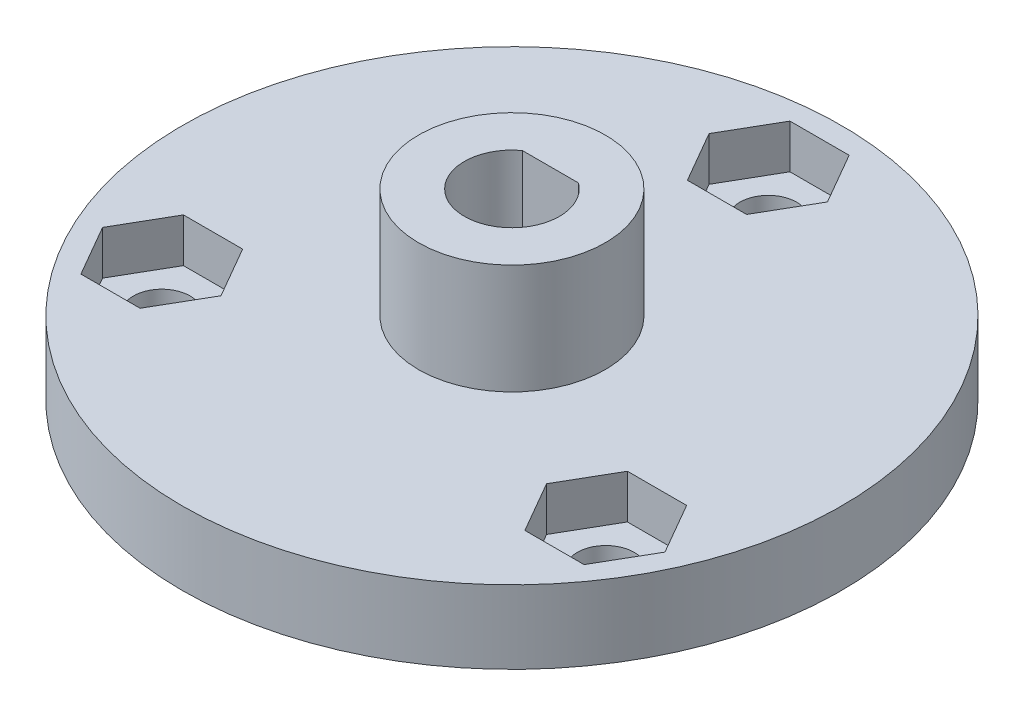
from build123d import *

# Parameters (mm, degrees)
SKETCH_1_R          = 18
SKETCH_1_R_2        = 1.55
EXTRUDE_1_DEPTH     = 4
SKETCH_3_R          = 2.6
CUT_EXTRUDE_2_DEPTH = 2
CUT_EXTRUDE_3_DEPTH = 26.53429067
SKETCH_5_R          = 5.1
EXTRUDE_2_DEPTH     = 6
CUT_EXTRUDE_START   = 2.4
SKETCH_2_R          = 1.55
CUT_EXTRUDE_4_DEPTH = 2.4


with BuildPart() as part:
    # 草图1 → 凸台-拉伸1 (new body)
    with BuildSketch(Plane(origin=(0, 0, 0), x_dir=(1, 0, 0), z_dir=(0, 1, 0))):
        Circle(SKETCH_1_R)
        with Locations((-12.124355653, -7)):
            Circle(SKETCH_1_R_2, mode=Mode.SUBTRACT)
        with Locations((0, 14)):
            Circle(SKETCH_1_R_2, mode=Mode.SUBTRACT)
        with Locations((12.124355653, -7)):
            Circle(SKETCH_1_R_2, mode=Mode.SUBTRACT)
    extrude(amount=EXTRUDE_1_DEPTH)

    # 草图3 → 切除-拉伸2 (cut)
    with BuildSketch(Plane.XZ):
        Circle(SKETCH_3_R)
    extrude(amount=-CUT_EXTRUDE_2_DEPTH, mode=Mode.SUBTRACT)

    # 草图4 → 切除-拉伸3 (cut, through all)
    with BuildSketch(Plane.XZ.offset(-2)):
        with BuildLine():
            ThreePointArc((2.6, 0), (-1.177768117, 2.317943542), (-1.532970972, -2.1))
            Line((-1.532970972, -2.1), (1.532970972, -2.1))
            ThreePointArc((1.532970972, -2.1), (2.317943542, -1.177768117), (2.6, 0))
        make_face()
    extrude(amount=-CUT_EXTRUDE_3_DEPTH, mode=Mode.SUBTRACT)

    # 草图5 → 凸台-拉伸2 (add)
    with BuildSketch(Plane(origin=(0, 4, 0), x_dir=(1, 0, 0), z_dir=(0, 1, 0))):
        Circle(SKETCH_5_R)
        with BuildLine():
            Line((-1.532970972, 2.1), (1.532970972, 2.1))
            ThreePointArc((1.532970972, 2.1), (0, -2.6), (-1.532970972, 2.1))
        make_face(mode=Mode.SUBTRACT)
    extrude(amount=EXTRUDE_2_DEPTH)

    # 草图2 → 切除-拉伸4 (cut)
    # profile 1 of 3: a face of its own
    with BuildSketch(Plane.XZ.offset(-4).offset(CUT_EXTRUDE_START)):
        Polygon((-8.891194146, 7), (-10.507774899, 9.8), (-13.740936407, 9.8), (-15.35751716, 7), (-13.740936407, 4.2), (-10.507774899, 4.2), align=None)
        with Locations((-12.124355653, 7)):
            Circle(SKETCH_2_R, mode=Mode.SUBTRACT)
    # profile 2 of 3: a face of its own
    with BuildSketch(Plane.XZ.offset(-4).offset(CUT_EXTRUDE_START)):
        Polygon((-1.616580754, -11.2), (-3.233161507, -14), (-1.616580754, -16.8), (1.616580754, -16.8), (3.233161507, -14), (1.616580754, -11.2), align=None)
        with Locations((0, -14)):
            Circle(SKETCH_2_R, mode=Mode.SUBTRACT)
    # profile 3 of 3: a face of its own
    with BuildSketch(Plane.XZ.offset(-4).offset(CUT_EXTRUDE_START)):
        Polygon((10.507774899, 4.2), (13.740936407, 4.2), (15.35751716, 7), (13.740936407, 9.8), (10.507774899, 9.8), (8.891194146, 7), align=None)
        with Locations((12.124355653, 7)):
            Circle(SKETCH_2_R, mode=Mode.SUBTRACT)
    extrude(amount=-CUT_EXTRUDE_4_DEPTH, mode=Mode.SUBTRACT)


solid = part.part
